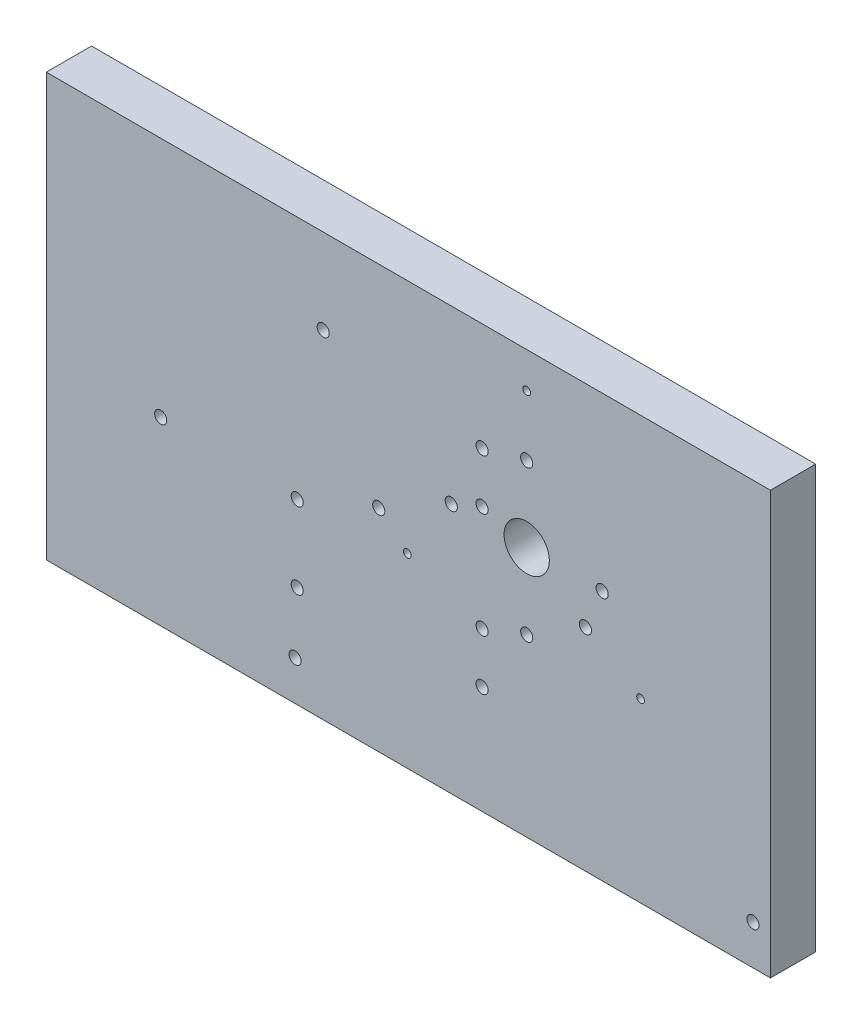
from build123d import *

# Parameters (mm, degrees)
SKETCH1_W           = 304.8
SKETCH1_H           = 177.8
BOSS_EXTRUDE1_DEPTH = 19.05
SKETCH2_R           = 2.5527
SKETCH2_R_2         = 1.63195
SKETCH2_R_3         = 9.525
CUT_EXTRUDE1_DEPTH  = 178.459495379
SKETCH10_R          = 2.5527
CUT_EXTRUDE2_DEPTH  = 178.459495379


with BuildPart() as part:
    # Sketch1 → Boss-Extrude1 (new body)
    with BuildSketch(Plane.XY):
        Rectangle(SKETCH1_W, SKETCH1_H)
    extrude(amount=-BOSS_EXTRUDE1_DEPTH)

    # Sketch2 → Cut-Extrude1 (cut, through all)
    with BuildSketch(Plane.XY):
        with Locations((-104.248655176, -12.758541966)):
            Circle(SKETCH2_R)
        with Locations((-46.793240461, -46.174477312)):
            Circle(SKETCH2_R)
        with Locations((18.05555, 16.7132)):
            Circle(SKETCH2_R)
        with Locations((-35.851762373, 53.135528594)):
            Circle(SKETCH2_R)
        with Locations((-47.693929175, -72.1868)):
            Circle(SKETCH2_R)
        with Locations((49.80555, 48.4632)):
            Circle(SKETCH2_R)
        with Locations((81.55555, 16.7132)):
            Circle(SKETCH2_R)
        with Locations((49.80555, -15.0368)):
            Circle(SKETCH2_R)
        with Locations((-46.793240461, -14.002181532)):
            Circle(SKETCH2_R)
        with Locations((49.80555, 73.8632)):
            Circle(SKETCH2_R_2)
        with Locations((145.05555, -72.1868)):
            Circle(SKETCH2_R)
        with Locations((-0.418847989, -10.556423149)):
            Circle(SKETCH2_R_2)
        with Locations((97.735572958, -14.412920851)):
            Circle(SKETCH2_R_2)
        with Locations((49.80555, 16.7132)):
            Circle(SKETCH2_R_3)
    extrude(amount=-CUT_EXTRUDE1_DEPTH, mode=Mode.SUBTRACT)

    # Sketch10 → Cut-Extrude2 (cut, through all)
    with BuildSketch(Plane.XY):
        with Locations((-12.473887774, 0)):
            Circle(SKETCH10_R)
        with Locations((31.026112348, -43.500000122)):
            Circle(SKETCH10_R)
        with Locations((74.52611247, 0)):
            Circle(SKETCH10_R)
        with Locations((31.026112348, 43.500000122)):
            Circle(SKETCH10_R)
        with Locations((31.026112348, 22.225)):
            Circle(SKETCH10_R)
        with Locations((31.026112348, -22.225)):
            Circle(SKETCH10_R)
    extrude(amount=-CUT_EXTRUDE2_DEPTH, mode=Mode.SUBTRACT)


solid = part.part
